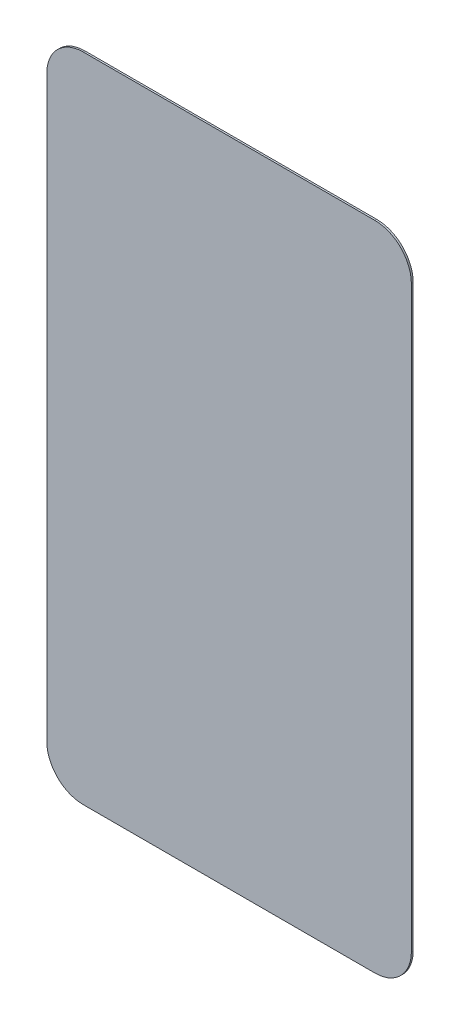
from build123d import *

# Parameters (mm, degrees)
EXTRUDE_1_DEPTH = 0.5


with BuildPart() as part:
    # Эскиз1 → Вытянуть1 (new body)
    with BuildSketch(Plane.XY):
        with BuildLine():
            Line((-32.468529509, 91.343624557), (47.531470491, 91.343624557))
            ThreePointArc((47.531470491, 91.343624557), (54.602538303, 88.414692369), (57.531470491, 81.343624557))
            Line((57.531470491, 81.343624557), (57.531470491, -77.471354009))
            ThreePointArc((57.531470491, -77.471354009), (54.602538303, -84.542421821), (47.531470491, -87.471354009))
            Line((47.531470491, -87.471354009), (-32.468529509, -87.471354009))
            ThreePointArc((-32.468529509, -87.471354009), (-39.539597321, -84.542421821), (-42.468529509, -77.471354009))
            Line((-42.468529509, -77.471354009), (-42.468529509, 81.343624557))
            ThreePointArc((-42.468529509, 81.343624557), (-39.539597321, 88.414692369), (-32.468529509, 91.343624557))
        make_face()
    extrude(amount=EXTRUDE_1_DEPTH)


solid = part.part
